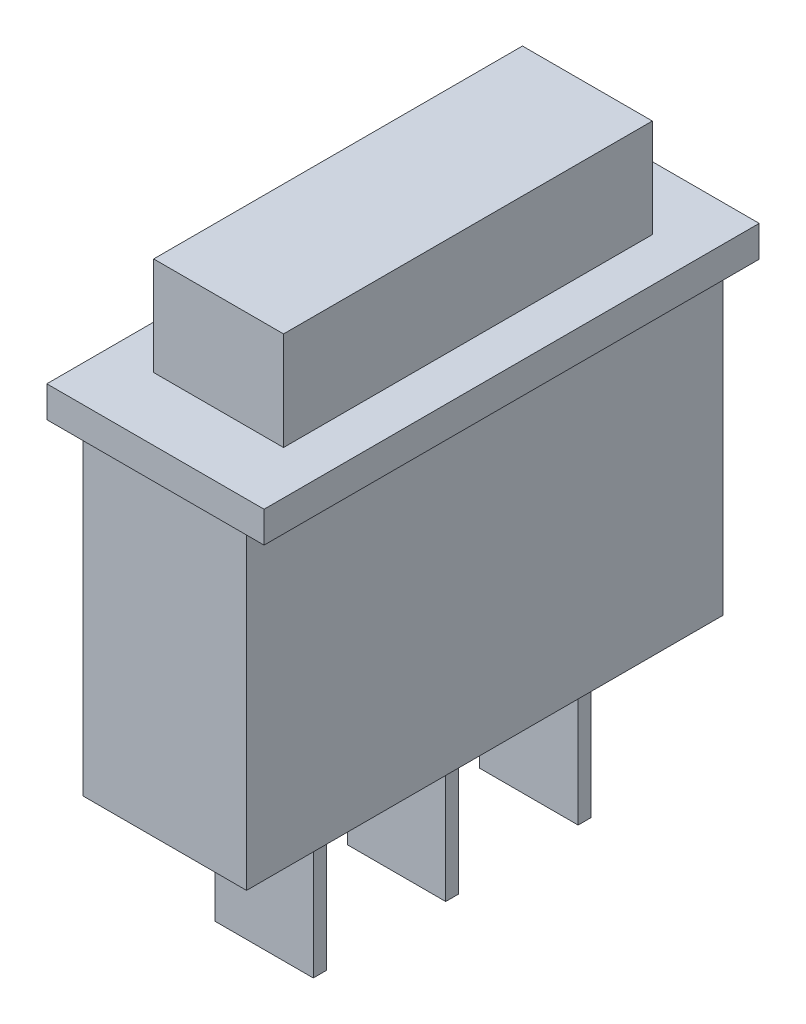
from build123d import *

# Parameters (mm, degrees)
SKETCH1_W           = 10.541
SKETCH1_H           = 30.734
BOSS_EXTRUDE1_DEPTH = 20.4724
SKETCH2_W           = 14.0208
SKETCH2_H           = 31.9532
BOSS_EXTRUDE2_DEPTH = 2.0066
SKETCH3_W           = 8.382
SKETCH3_H           = 23.7998
BOSS_EXTRUDE3_DEPTH = 6.35
SKETCH4_W           = 6.35
SKETCH4_H           = 0.8382
BOSS_EXTRUDE4_DEPTH = 9.144


with BuildPart() as part:
    # Sketch1 → Boss-Extrude1 (new body)
    with BuildSketch(Plane(origin=(0, 0, 0), x_dir=(1, 0, 0), z_dir=(0, 1, 0))):
        with Locations((5.2705, 15.367)):
            Rectangle(SKETCH1_W, SKETCH1_H)
    extrude(amount=BOSS_EXTRUDE1_DEPTH)

    # Sketch2 → Boss-Extrude2 (add)
    with BuildSketch(Plane(origin=(0, 20.4724, 0), x_dir=(1, 0, 0), z_dir=(0, 1, 0))):
        with Locations((5.2705, 15.367)):
            Rectangle(SKETCH2_W, SKETCH2_H)
    extrude(amount=BOSS_EXTRUDE2_DEPTH)

    # Sketch3 → Boss-Extrude3 (add)
    with BuildSketch(Plane(origin=(0, 22.479, 0), x_dir=(1, 0, 0), z_dir=(0, 1, 0))):
        with Locations((5.2705, 15.367)):
            Rectangle(SKETCH3_W, SKETCH3_H)
    extrude(amount=BOSS_EXTRUDE3_DEPTH)

    # Sketch4 → Boss-Extrude4 (add)
    with BuildSketch(Plane.XZ):
        with Locations((5.2705, -23.913230798)):
            Rectangle(SKETCH4_W, SKETCH4_H)
        with Locations((5.2705, -15.367)):
            Rectangle(SKETCH4_W, SKETCH4_H)
        with Locations((5.2705, -6.820769202)):
            Rectangle(SKETCH4_W, SKETCH4_H)
    extrude(amount=BOSS_EXTRUDE4_DEPTH)


solid = part.part
